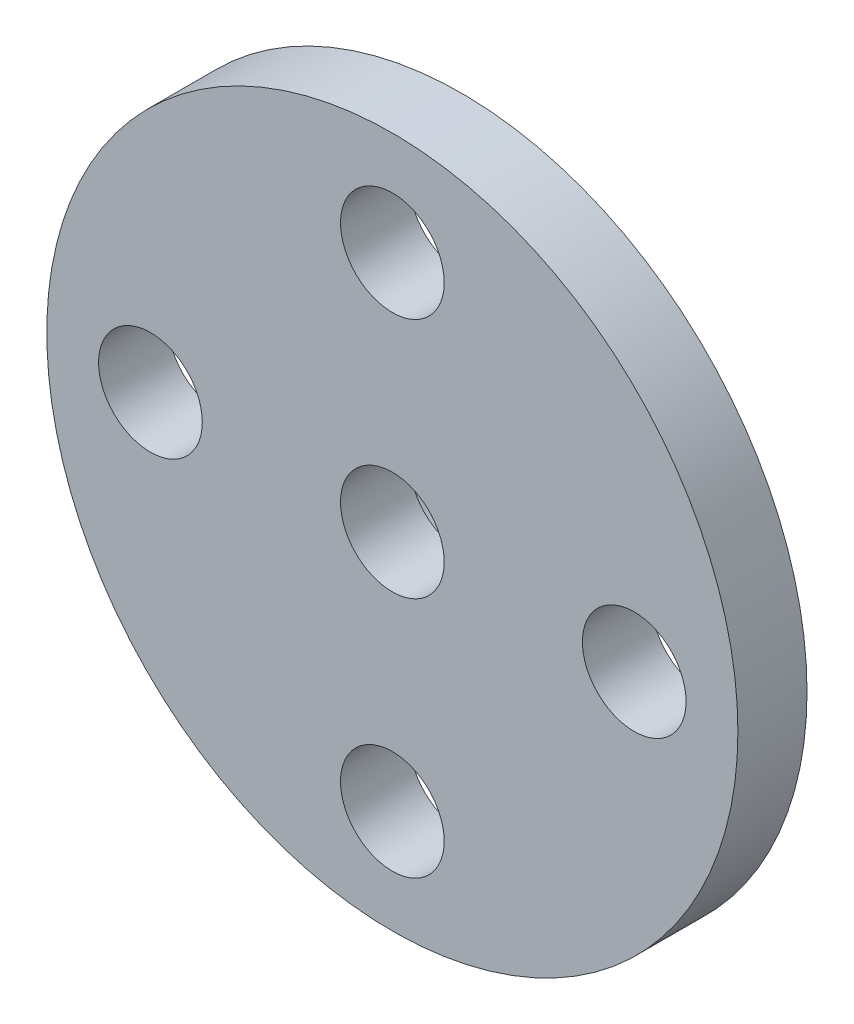
from build123d import *

# Parameters (mm, degrees)
SKETCH_1_R      = 10
SKETCH_1_R_2    = 1.5
EXTRUDE_1_DEPTH = 2
SKETCH_2_R      = 4.5
SKETCH_2_R_2    = 3
EXTRUDE_2_DEPTH = 2


with BuildPart() as part:
    # 草图1 → 凸台-拉伸1 (new body)
    with BuildSketch(Plane.XY):
        Circle(SKETCH_1_R)
        Circle(SKETCH_1_R_2, mode=Mode.SUBTRACT)
        with Locations((0, 7)):
            Circle(SKETCH_1_R_2, mode=Mode.SUBTRACT)
        with Locations((7, 0)):
            Circle(SKETCH_1_R_2, mode=Mode.SUBTRACT)
        with Locations((0, -7)):
            Circle(SKETCH_1_R_2, mode=Mode.SUBTRACT)
        with Locations((-7, 0)):
            Circle(SKETCH_1_R_2, mode=Mode.SUBTRACT)
    extrude(amount=EXTRUDE_1_DEPTH)

    # 草图2 → 凸台-拉伸2 (add)
    with BuildSketch(Plane(origin=(0, 0, 0), x_dir=(-1, 0, 0), z_dir=(0, 0, -1))):
        with Locations(Location((0, 0, 0), (0, 0, 180))):
            Circle(SKETCH_2_R)
        Circle(SKETCH_2_R_2, mode=Mode.SUBTRACT)
    extrude(amount=EXTRUDE_2_DEPTH)


solid = part.part
